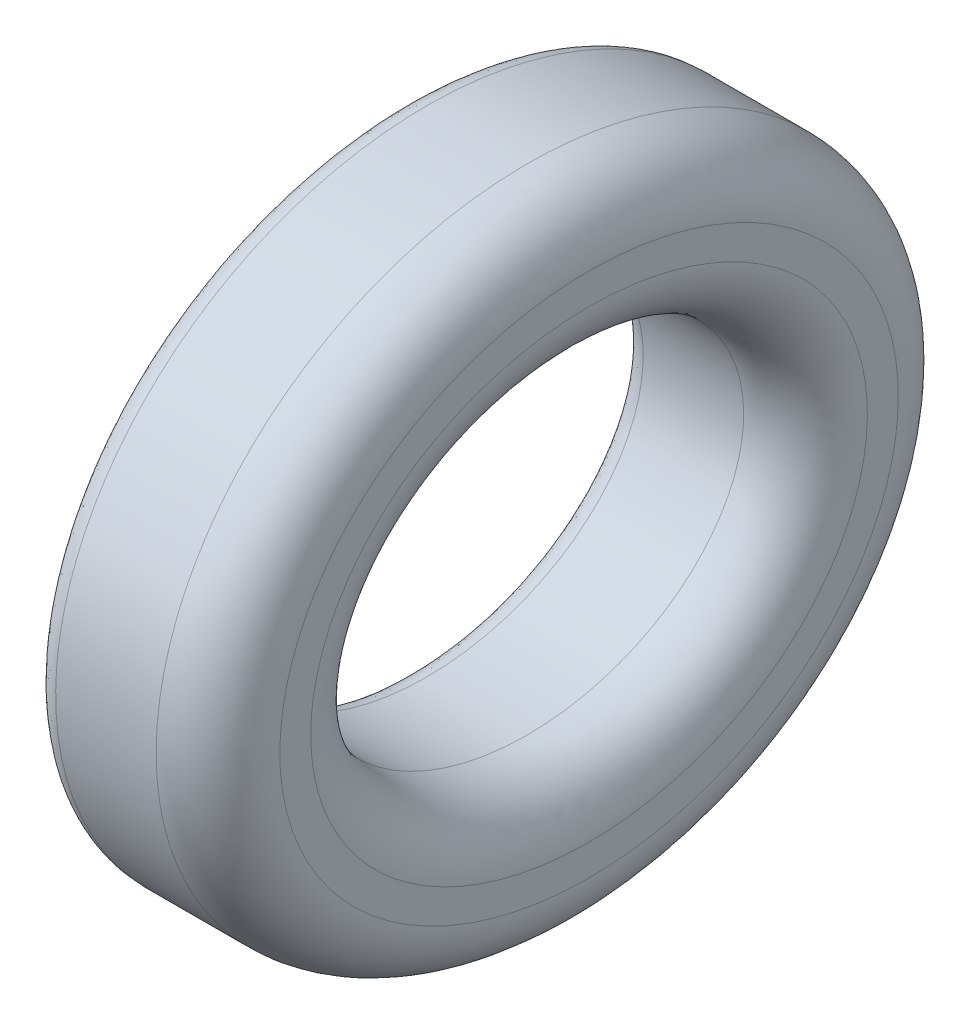
from build123d import *

# Parameters (mm, degrees)
SKETCH1_RX   = 48
SKETCH1_RY   = 42
SKETCH1_RX_2 = 28
SKETCH1_RY_2 = 22
PAD_DEPTH    = 12
FACEROUND_R  = 8
BASEROUND_R  = 3


with BuildPart() as part:
    # Sketch1 → Pad (new, symmetric)
    with BuildSketch(Plane.YZ.offset(26)):
        with Locations(Location((0, -56), (0, 0, -90))):
            Ellipse(SKETCH1_RX, SKETCH1_RY)
        with Locations(Location((0, -56), (0, 0, -90))):
            Ellipse(SKETCH1_RX_2, SKETCH1_RY_2, mode=Mode.SUBTRACT)
    extrude(amount=PAD_DEPTH, both=True)

    # FaceRound
    faceround_edges = [part.edges().sort_by_distance(p)[0] for p in [
        (38, -0.001351531, -8.000000025),
        (38, -0.004395644, -28.000000559),
    ]]
    fillet(faceround_edges, radius=FACEROUND_R)

    # BaseRound
    baseround_edges = [part.edges().sort_by_distance(p)[0] for p in [
        (14, -0.001351531, -8.000000025),
        (14, -0.004395644, -28.000000559),
    ]]
    fillet(baseround_edges, radius=BASEROUND_R)


solid = part.part
